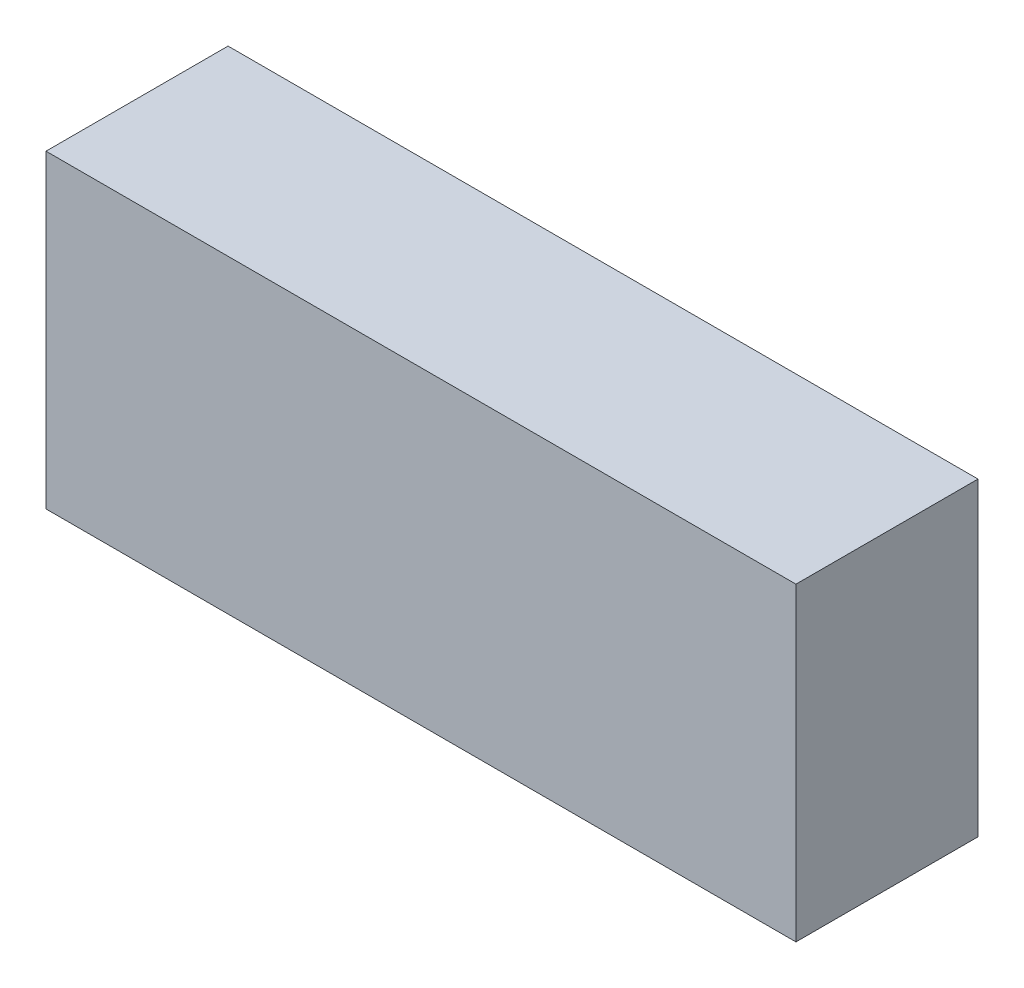
from build123d import *

# Parameters (mm, degrees)
SKETCH1_W           = 123.578897528
SKETCH1_H           = 51.058508082
BOSS_EXTRUDE1_DEPTH = 30


with BuildPart() as part:
    # Sketch1 → Boss-Extrude1 (new body)
    with BuildSketch(Plane.XY):
        Rectangle(SKETCH1_W, SKETCH1_H)
    extrude(amount=BOSS_EXTRUDE1_DEPTH)


solid = part.part
